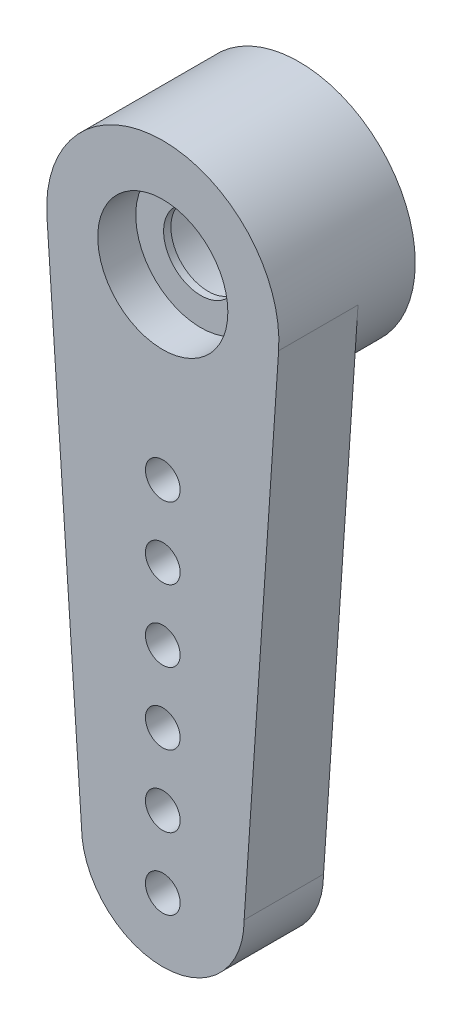
from build123d import *

# Parameters (mm, degrees)
SKETCH1_R           = 3.5687
SKETCH1_R_2         = 2
BOSS_EXTRUDE1_DEPTH = 4.191
SKETCH5_R           = 2
SKETCH5_R_2         = 1.143
BOSS_EXTRUDE2_DEPTH = 0.2226
BOSS_EXTRUDE3_START = -2.441
SKETCH6_R           = 0.5334
BOSS_EXTRUDE3_DEPTH = 2.441


with BuildPart() as part:
    # Sketch1 → Boss-Extrude1 (new body)
    with BuildSketch(Plane.XY.offset(-7.032965862)):
        Circle(SKETCH1_R)
        Circle(SKETCH1_R_2, mode=Mode.SUBTRACT)
    extrude(amount=BOSS_EXTRUDE1_DEPTH)

    # Sketch5 → Boss-Extrude2 (add)
    with BuildSketch(Plane.XY.offset(-4.232965862)):
        Circle(SKETCH5_R)
        Circle(SKETCH5_R_2, mode=Mode.SUBTRACT)
    extrude(amount=BOSS_EXTRUDE2_DEPTH)

    # Sketch6 → Boss-Extrude3 (add)
    with BuildSketch(Plane.XY.offset(-2.841965862).offset(BOSS_EXTRUDE3_START)):
        with BuildLine():
            Line((2.5, -15.9313), (3.56, -0.249037527))
            ThreePointArc((3.56, -0.249037527), (0, -3.5687), (-3.56, -0.249037527))
            Line((-3.56, -0.249037527), (-2.5, -15.9313))
            ThreePointArc((-2.5, -15.9313), (0, -18.4313), (2.5, -15.9313))
        make_face()
        with Locations((0, -14.2647)):
            Circle(SKETCH6_R, mode=Mode.SUBTRACT)
        with Locations((0, -16.4647)):
            Circle(SKETCH6_R, mode=Mode.SUBTRACT)
        with Locations((0, -12.0647)):
            Circle(SKETCH6_R, mode=Mode.SUBTRACT)
        with Locations((0, -9.8647)):
            Circle(SKETCH6_R, mode=Mode.SUBTRACT)
        with Locations((0, -7.6647)):
            Circle(SKETCH6_R, mode=Mode.SUBTRACT)
        with Locations((0, -5.4647)):
            Circle(SKETCH6_R, mode=Mode.SUBTRACT)
    extrude(amount=BOSS_EXTRUDE3_DEPTH)


solid = part.part
